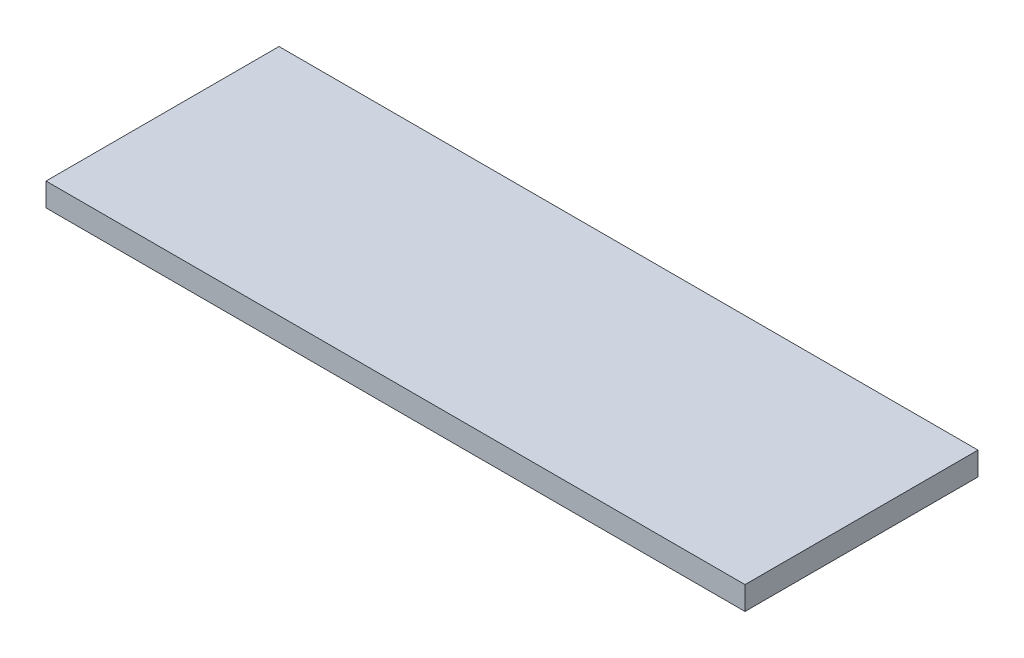
from build123d import *

# Parameters (mm, degrees)
SKETCH1_W           = 150
SKETCH1_H           = 50
BOSS_EXTRUDE1_DEPTH = 5


with BuildPart() as part:
    # Sketch1 → Boss-Extrude1 (new body)
    with BuildSketch(Plane(origin=(0, 0, 0), x_dir=(1, 0, 0), z_dir=(0, 1, 0))):
        Rectangle(SKETCH1_W, SKETCH1_H)
    extrude(amount=BOSS_EXTRUDE1_DEPTH)


solid = part.part
